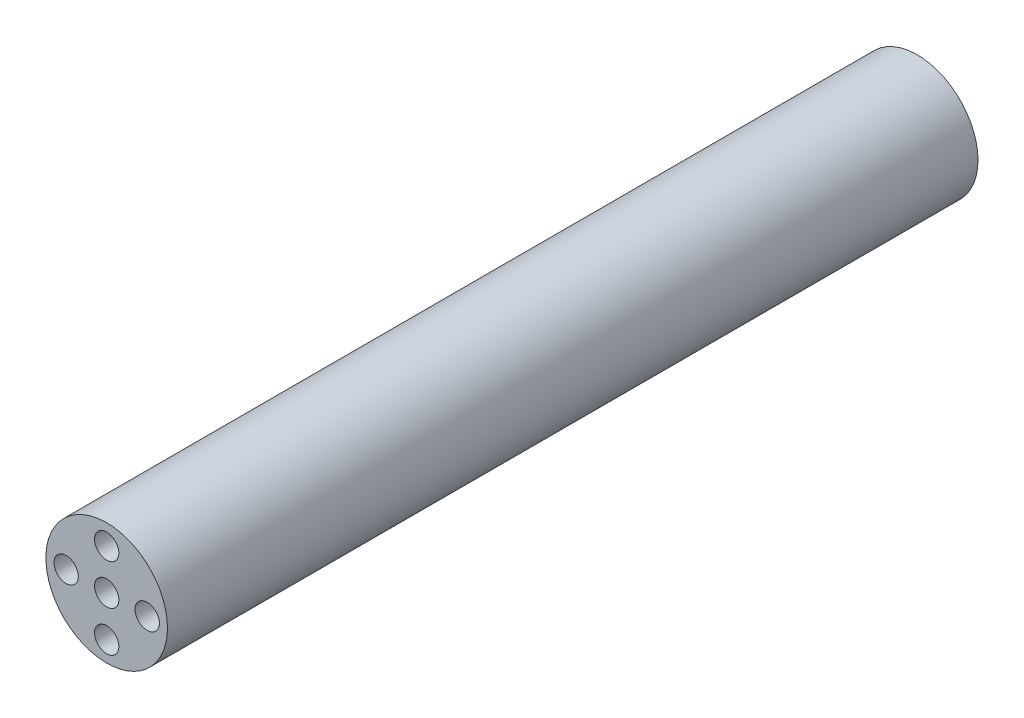
from build123d import *

# Parameters (mm, degrees)
SKETCH_1_R      = 7.5
SKETCH_1_R_2    = 1.5
EXTRUDE_1_DEPTH = 100


with BuildPart() as part:
    # 草图1 → 凸台-拉伸1 (new body)
    with BuildSketch(Plane.XY):
        Circle(SKETCH_1_R)
        Circle(SKETCH_1_R_2, mode=Mode.SUBTRACT)
        with Locations((0, 5)):
            Circle(SKETCH_1_R_2, mode=Mode.SUBTRACT)
        with Locations((5, 0)):
            Circle(SKETCH_1_R_2, mode=Mode.SUBTRACT)
        with Locations((0, -5)):
            Circle(SKETCH_1_R_2, mode=Mode.SUBTRACT)
        with Locations((-5, 0)):
            Circle(SKETCH_1_R_2, mode=Mode.SUBTRACT)
    extrude(amount=EXTRUDE_1_DEPTH)


solid = part.part
